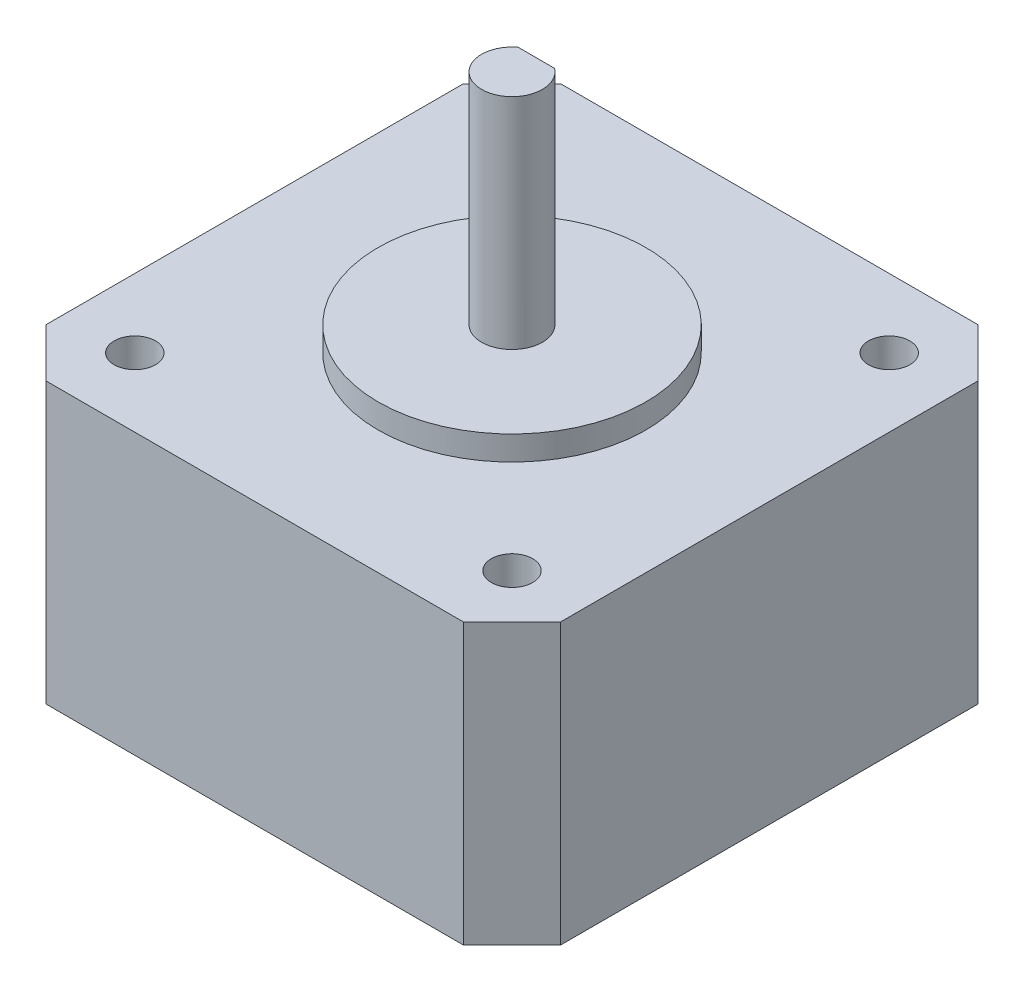
from build123d import *

# Parameters (mm, degrees)
ESTRUSIONE_ESTRUSIONE1_DEPTH   = 23
FORO_PER_VITE_M3_1_D           = 3.4
FORO_PER_VITE_M3_1_DEPTH       = 34
FORO_PER_VITE_M3_1_CSINK_D     = 3.45
FORO_PER_VITE_M3_1_CSINK_ANGLE = 90
FORO_PER_VITE_M3_1_TIP         = 1.021463052
SCHIZZO5_R                     = 11
ESTRUSIONE_ESTRUSIONE2_DEPTH   = 2
SCHIZZO6_R                     = 2.5
ESTRUSIONE_ESTRUSIONE3_DEPTH   = 18
TAGLIO_ESTRUSIONE1_START       = -17
TAGLIO_ESTRUSIONE1_DEPTH       = 17


with BuildPart() as part:
    # Schizzo1 → Estrusione-Estrusione1 (new body)
    with BuildSketch(Plane(origin=(0, 0, 0), x_dir=(1, 0, 0), z_dir=(0, 1, 0))):
        Polygon((21.15, -17.15), (21.15, 17.15), (17.15, 21.15), (-17.15, 21.15), (-21.15, 17.15), (-21.15, -17.15), (-17.15, -21.15), (17.15, -21.15), align=None)
    extrude(amount=ESTRUSIONE_ESTRUSIONE1_DEPTH)

    # Foro per Vite M3-1
    with Locations(Plane(origin=(0, 0, 0), x_dir=(-1, 0, 0), z_dir=(0, -1, 0))):
        with Locations((-15.5, 15.5), (15.5, 15.5), (15.5, -15.5), (-15.5, -15.5)):
            CounterSinkHole(FORO_PER_VITE_M3_1_D / 2, FORO_PER_VITE_M3_1_CSINK_D / 2, depth=FORO_PER_VITE_M3_1_DEPTH, counter_sink_angle=FORO_PER_VITE_M3_1_CSINK_ANGLE)
            with Locations((0, 0, -(FORO_PER_VITE_M3_1_DEPTH + FORO_PER_VITE_M3_1_TIP / 2))):  # 118° drill point
                Cone(0, FORO_PER_VITE_M3_1_D / 2, FORO_PER_VITE_M3_1_TIP, mode=Mode.SUBTRACT)

    # Schizzo5 → Estrusione-Estrusione2 (add)
    with BuildSketch(Plane(origin=(0, 23, 0), x_dir=(1, 0, 0), z_dir=(0, 1, 0))):
        with Locations(Location((0, 0, 0), (0, 0, 270))):
            Circle(SCHIZZO5_R)
    extrude(amount=ESTRUSIONE_ESTRUSIONE2_DEPTH)

    # Schizzo6 → Estrusione-Estrusione3 (add)
    with BuildSketch(Plane(origin=(0, 25, 0), x_dir=(1, 0, 0), z_dir=(0, 1, 0))):
        with Locations(Location((0, 0, 0), (0, 0, 270))):
            Circle(SCHIZZO6_R)
    extrude(amount=ESTRUSIONE_ESTRUSIONE3_DEPTH)

    # Schizzo7 → Taglio-Estrusione1 (cut)
    with BuildSketch(Plane(origin=(0, 43, 0), x_dir=(1, 0, 0), z_dir=(0, 1, 0)).offset(TAGLIO_ESTRUSIONE1_START)):
        with BuildLine():
            Line((-1.5, 2), (1.5, 2))
            ThreePointArc((1.5, 2), (0, 2.5), (-1.5, 2))
        make_face()
    extrude(amount=TAGLIO_ESTRUSIONE1_DEPTH, mode=Mode.SUBTRACT)


solid = part.part
